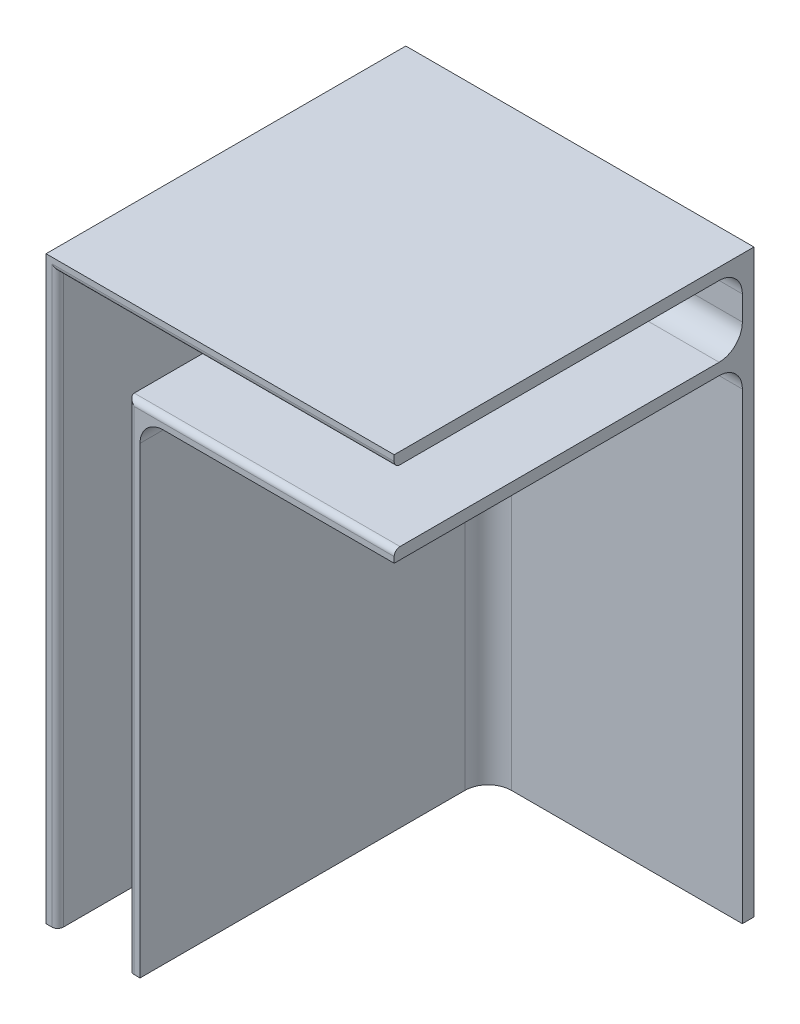
from build123d import *

# Parameters (mm, degrees)
SKETCH1_W           = 30
SKETCH1_H           = 50
BOSS_EXTRUDE1_DEPTH = 1
BOSS_EXTRUDE2_DEPTH = 30
FILLET1_R           = 2
FILLET2_R           = 0.5


with BuildPart() as part:
    # Sketch1 → Boss-Extrude1 (new body)
    with BuildSketch(Plane.XY):
        with Locations((15, 25)):
            Rectangle(SKETCH1_W, SKETCH1_H)
    extrude(amount=BOSS_EXTRUDE1_DEPTH)

    # Sketch2 → Boss-Extrude2 (add)
    with BuildSketch(Plane.XY.offset(1)):
        Polygon((0, 50), (30, 50), (30, 49), (1, 49), (1, 0), (0, 0), (0, 49), align=None)
        Polygon((30, 41.9), (8.1, 41.9), (8.1, 0), (7.1, 0), (7.1, 41.9), (7.1, 42.9), (30, 42.9), align=None)
    extrude(amount=BOSS_EXTRUDE2_DEPTH)

    # Fillet1
    fillet1_edges = [part.edges().sort_by_distance(p)[0] for p in [
        (1, 24.5, 1),
        (15.5, 49, 1),
        (18.55, 42.9, 1),
        (7.1, 21.45, 1),
        (8.1, 20.95, 1),
        (19.05, 41.9, 1),
        (8.1, 41.9, 16),
    ]]
    fillet(fillet1_edges, radius=FILLET1_R)

    # Fillet2
    fillet2_edges = [part.edges().sort_by_distance(p)[0] for p in [
        (1, 24.5, 31),
        (15.5, 49, 31),
        (18.55, 42.9, 31),
        (7.1, 21.45, 31),
    ]]
    fillet(fillet2_edges, radius=FILLET2_R)


solid = part.part
